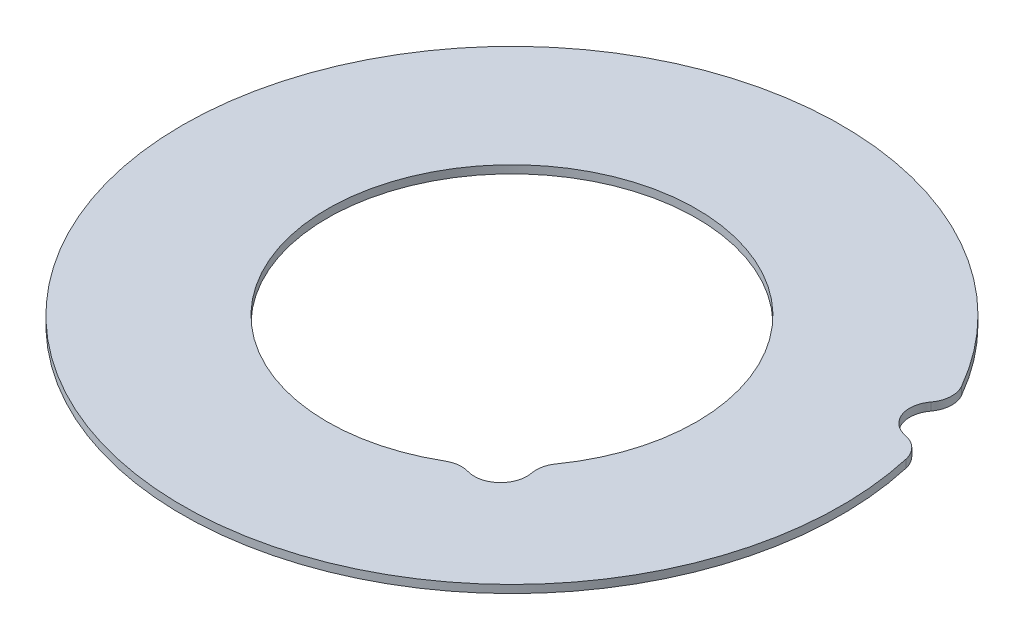
from build123d import *

# Parameters (mm, degrees)
SKETCH1_W          = 5.5
SKETCH1_H          = 0.3
SKETCH2_R          = 1
CUT_EXTRUDE1_DEPTH = 10
FILLET1_R          = 1


with BuildPart() as part:
    # Sketch1 → Revolve1 (revolve)
    with BuildSketch(Plane.XY, mode=Mode.PRIVATE) as revolve1_sk:
        with Locations((-9.75, 0.15)):
            Rectangle(SKETCH1_W, SKETCH1_H)
    revolve(revolve1_sk.sketch.rotate(Axis((0, 0, 0), (0, 1, 0)), 270), axis=Axis((0, 0, 0), (0, 1, 0)))

    # Sketch2 → Cut-Extrude1 (cut)
    with BuildSketch(Plane(origin=(0, 0.3, 0), x_dir=(1, 0, 0), z_dir=(0, 1, 0))):
        with Locations((4.571073678, -5)):
            Circle(SKETCH2_R)
        with Locations((11.589188307, 4.5)):
            Circle(SKETCH2_R)
    extrude(amount=-CUT_EXTRUDE1_DEPTH, mode=Mode.SUBTRACT)

    # Fillet1
    fillet1_edges = [part.edges().sort_by_distance(p)[0] for p in [
        (5.405006845, 0.15, 4.448134553),
        (3.946825109, 0.15, 5.781225783),
        (11.976907898, 0.15, -3.578222631),
        (11.253259969, 0.15, -5.441887547),
    ]]
    fillet(fillet1_edges, radius=FILLET1_R)


solid = part.part
